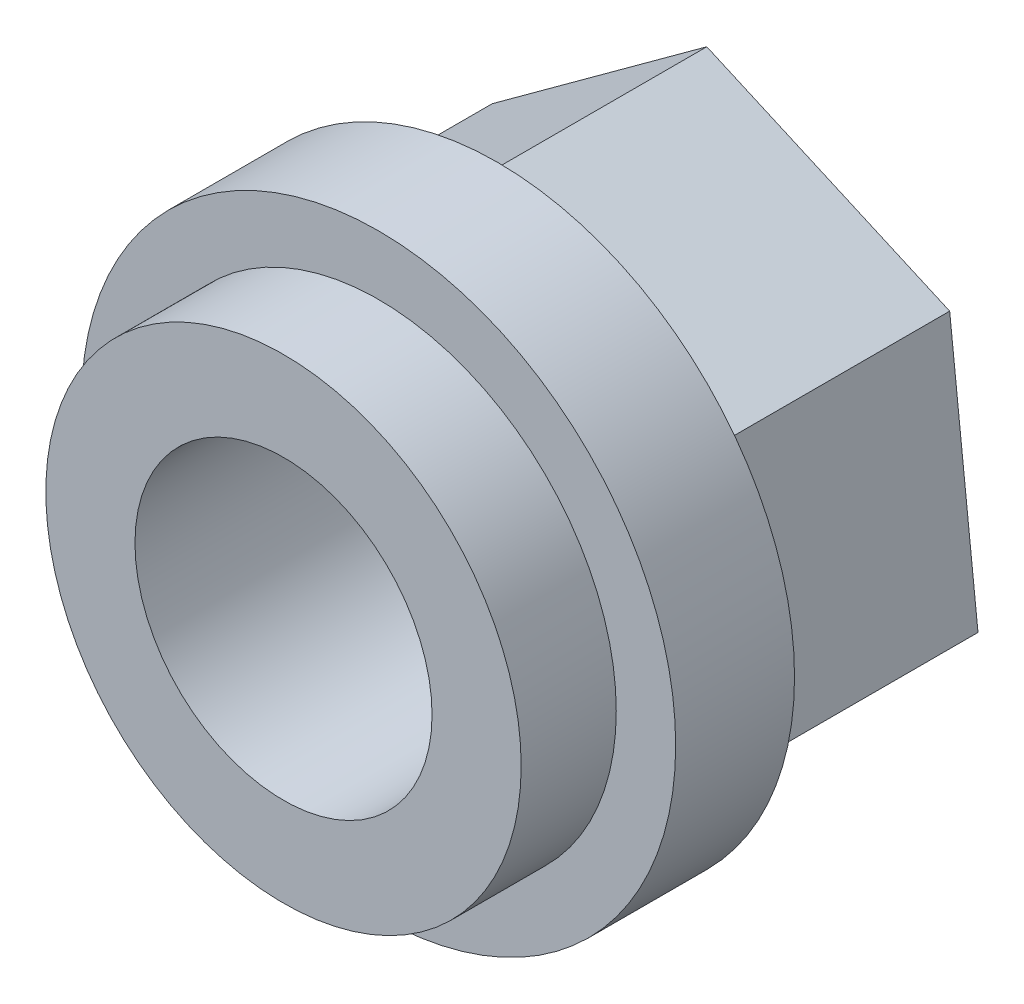
from build123d import *

# Parameters (mm, degrees)
SKETCH2_R           = 25
BOSS_EXTRUDE1_DEPTH = 10
SKETCH3_R           = 20
BOSS_EXTRUDE2_DEPTH = 8
BOSS_EXTRUDE3_DEPTH = 20
SKETCH5_R           = 12.5
CUT_EXTRUDE1_DEPTH  = 52.903757089


with BuildPart() as part:
    # Sketch2 → Boss-Extrude1 (new body)
    with BuildSketch(Plane.XY):
        Circle(SKETCH2_R)
    extrude(amount=BOSS_EXTRUDE1_DEPTH)

    # Sketch3 → Boss-Extrude2 (add)
    with BuildSketch(Plane.XY.offset(10)):
        Circle(SKETCH3_R)
    extrude(amount=BOSS_EXTRUDE2_DEPTH)

    # Sketch4 → Boss-Extrude3 (add)
    with BuildSketch(Plane(origin=(0, 0, 0), x_dir=(-1, 0, 0), z_dir=(0, 0, -1))):
        Polygon((-20.437108974, -9.047000469), (-2.383622252, -22.222555786), (18.053486721, -13.175555316), (20.437108974, 9.047000469), (2.383622252, 22.222555786), (-18.053486721, 13.175555316), align=None)
    extrude(amount=BOSS_EXTRUDE3_DEPTH)

    # Sketch5 → Cut-Extrude1 (cut, through all)
    with BuildSketch(Plane(origin=(0, 0, -20), x_dir=(-1, 0, 0), z_dir=(0, 0, -1))):
        Circle(SKETCH5_R)
    extrude(amount=-CUT_EXTRUDE1_DEPTH, mode=Mode.SUBTRACT)


solid = part.part
